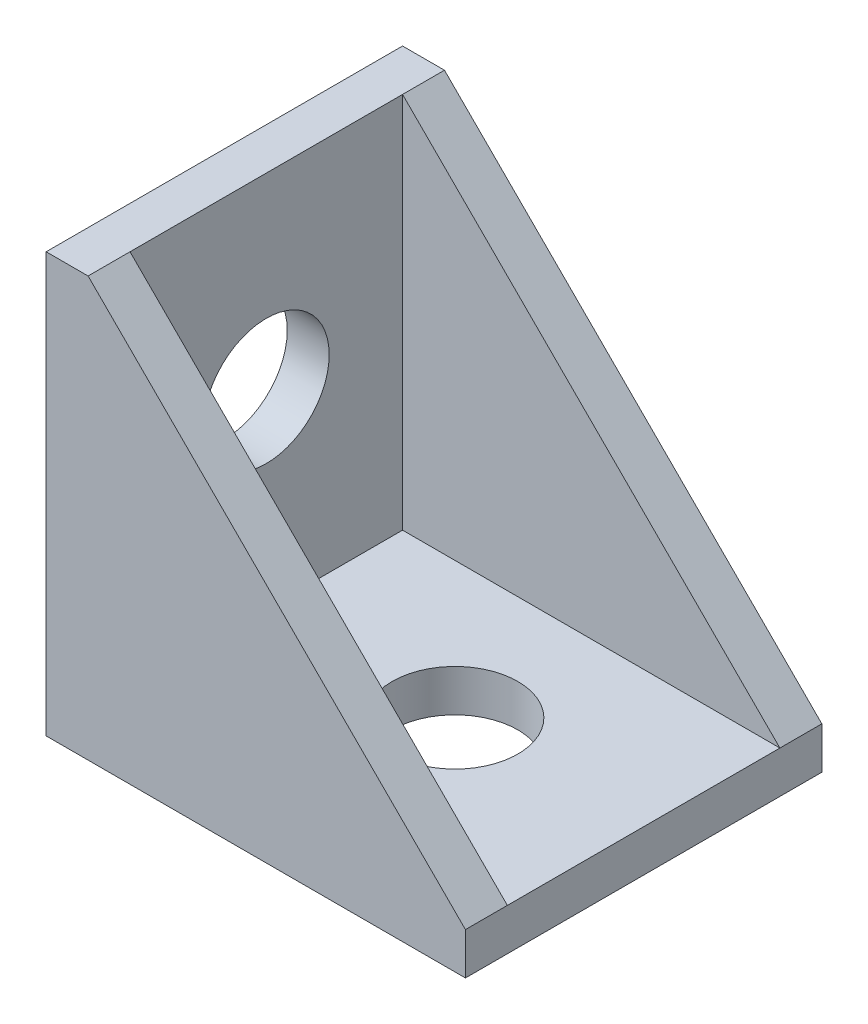
from build123d import *

# Parameters (mm, degrees)
RESSALTO_EXTRUS_O1_DEPTH = 17
ESBO_O2_W                = 18
ESBO_O2_H                = 13
CORTE_EXTRUS_O1_DEPTH    = 18
ESBO_O3_R                = 3
CORTE_EXTRUS_O2_DEPTH    = 2
ESBO_O4_R                = 3
CORTE_EXTRUS_O3_DEPTH    = 32.827660926


with BuildPart() as part:
    # Esboço1 → Ressalto-extrusão1 (new body)
    with BuildSketch(Plane.XY):
        Polygon((0, 0), (0, 20), (2, 20), (20, 2), (20, 0), align=None)
    extrude(amount=RESSALTO_EXTRUS_O1_DEPTH)

    # Esboço2 → Corte-extrusão1 (cut)
    with BuildSketch(Plane(origin=(0, 20, 0), x_dir=(1, 0, 0), z_dir=(0, 1, 0))):
        with Locations((11, -8.5)):
            Rectangle(ESBO_O2_W, ESBO_O2_H)
    extrude(amount=-CORTE_EXTRUS_O1_DEPTH, mode=Mode.SUBTRACT)

    # Esboço3 → Corte-extrusão2 (cut)
    with BuildSketch(Plane(origin=(2, 0, 0), x_dir=(0, 0, -1), z_dir=(1, 0, 0))):
        with Locations((-8.5, 11)):
            Circle(ESBO_O3_R)
    extrude(amount=-CORTE_EXTRUS_O2_DEPTH, mode=Mode.SUBTRACT)

    # Esboço4 → Corte-extrusão3 (cut, through all)
    with BuildSketch(Plane(origin=(0, 2, 0), x_dir=(1, 0, 0), z_dir=(0, 1, 0))):
        with Locations(Location((11, -8.5, 0), (0, 0, 180))):
            Circle(ESBO_O4_R)
    extrude(amount=-CORTE_EXTRUS_O3_DEPTH, mode=Mode.SUBTRACT)


solid = part.part
